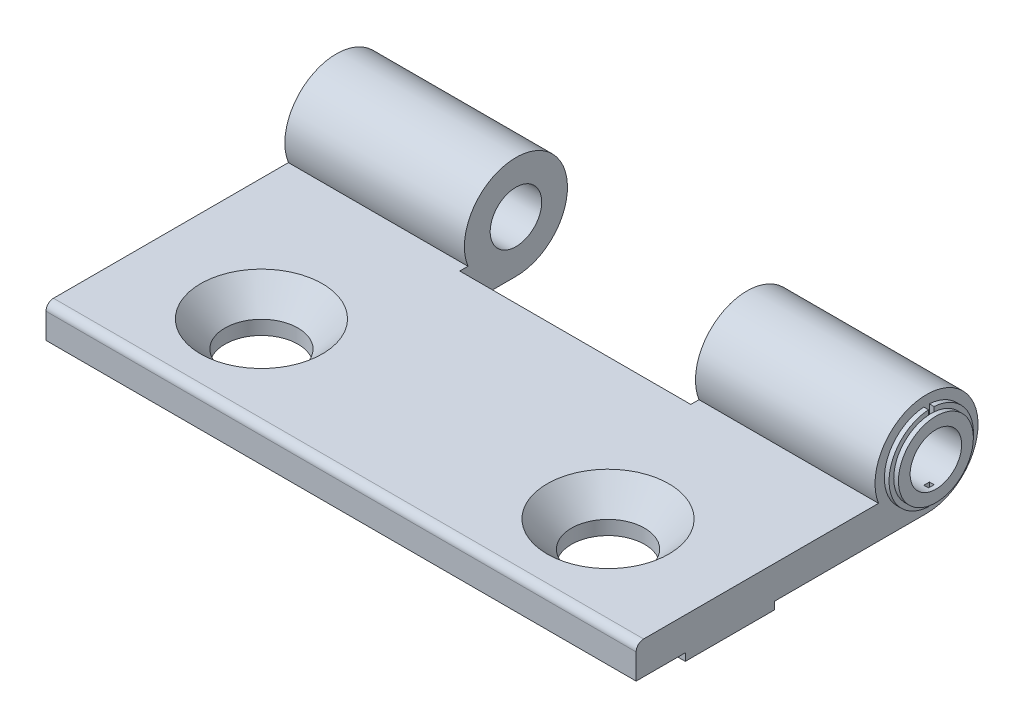
from build123d import *

# Parameters (mm, degrees)
BOSS_EXTRUDE1_DEPTH    = 19.166666667
BOSS_EXTRUDE2_DEPTH    = 0.5
SKETCH3_W              = 5.123475383
SKETCH3_H              = 3.5
BOSS_EXTRUDE3_DEPTH    = 24.666666667
BOSS_EXTRUDE4_START    = 19.166666667
BOSS_EXTRUDE4_DEPTH    = 19.166666667
BOSS_EXTRUDE5_START    = 0.5
BOSS_EXTRUDE5_DEPTH    = 0.5
BOSS_EXTRUDE6_START    = 0.5
BOSS_EXTRUDE6_DEPTH    = 0.5
CUT_EXTRUDE1_DEPTH     = 19.166666667
SKETCH8_W              = 63
SKETCH8_H              = 3.5
BOSS_EXTRUDE7_DEPTH    = 0.338316441
SKETCH9_W              = 63
SKETCH9_H              = 5.461791824
BOSS_EXTRUDE8_DEPTH    = 0.8
CUT_EXTRUDE2_DEPTH     = 5.123475383
SKETCH11_W             = 63
SKETCH11_H             = 4.3
BOSS_EXTRUDE9_DEPTH    = 25.538208176
CUT_EXTRUDE3_DEPTH     = 0.338316441
SKETCH13_W             = 63
SKETCH13_H             = 0.8
CUT_EXTRUDE4_DEPTH     = 10.788208176
SKETCH14_W             = 24.666666666
SKETCH14_H             = 3.5
CUT_EXTRUDE5_DEPTH     = 0.538208176
BOSS_EXTRUDE10_START   = 0.5
SKETCH15_R             = 4
SKETCH15_R_2           = 2.75
BOSS_EXTRUDE10_DEPTH   = 0.5
SKETCH16_R             = 4
BOSS_EXTRUDE11_DEPTH   = 0.5
SKETCH17_W             = 5.25
SKETCH17_H             = 0.8
CUT_EXTRUDE6_DEPTH     = 72.95832127
F_10_CLEARANCE_HOLE1_D = 5.5
HOLE1_AT_2_COUNT       = 2
HOLE1_AT_2_PITCH       = 37
FILLET1_R              = 0.8
SCALE1_SCALE           = 0.3333


with BuildPart() as part:
    # Sketch1 → Boss-Extrude1 (new body)
    with BuildSketch(Plane(origin=(-12.333333333, 0, 0), x_dir=(0, 0, -1), z_dir=(1, 0, 0))):
        with BuildLine():
            Line((-5.123475383, 3.5), (-5.123475383, 0))
            Line((-5.123475383, 0), (0, 0))
            ThreePointArc((0, 0), (3.102418411, 10.041475531), (-5.123475383, 3.5))
        make_face()
    extrude(amount=-BOSS_EXTRUDE1_DEPTH)

    # Sketch2 → Boss-Extrude2 (add)
    with BuildSketch(Plane.ZY.offset(31.5)):
        with BuildLine():
            Line((-0.3, 9.989988864), (-0.3, 8.233587387))
            ThreePointArc((-0.3, 8.233587387), (0, 8.25), (0.3, 8.233587387))
            Line((0.3, 8.233587387), (0.3, 9.989988864))
            ThreePointArc((0.3, 9.989988864), (4.5, 5.5), (0.3, 1.010011136))
            Line((0.3, 1.010011136), (0.3, 2.766412613))
            ThreePointArc((0.3, 2.766412613), (0, 2.75), (-0.3, 2.766412613))
            Line((-0.3, 2.766412613), (-0.3, 1.010011136))
            ThreePointArc((-0.3, 1.010011136), (-4.5, 5.5), (-0.3, 9.989988864))
        make_face()
    extrude(amount=BOSS_EXTRUDE2_DEPTH)

    # Sketch3 → Boss-Extrude3 (add)
    with BuildSketch(Plane(origin=(-12.333333333, 0, 0), x_dir=(0, 0, -1), z_dir=(1, 0, 0))):
        with Locations((-2.561737692, 1.75)):
            Rectangle(SKETCH3_W, SKETCH3_H)
    extrude(amount=BOSS_EXTRUDE3_DEPTH)

    # Sketch4 → Boss-Extrude4 (add)
    with BuildSketch(Plane(origin=(12.333333333, 0, 0), x_dir=(0, 0, -1), z_dir=(1, 0, 0)).offset(BOSS_EXTRUDE4_START)):
        with BuildLine():
            Line((0, 0), (-5.123475383, 0))
            Line((-5.123475383, 0), (-5.123475383, 3.5))
            ThreePointArc((-5.123475383, 3.5), (3.102418411, 10.041475531), (0, 0))
        make_face()
        with BuildLine():
            Line((-1.887458609, 3.5), (0, 3.5))
            Line((0, 3.5), (0, 2.75))
            ThreePointArc((0, 2.75), (1.015504801, 8.055631038), (-1.887458609, 3.5))
        make_face(mode=Mode.SUBTRACT)
    extrude(amount=-BOSS_EXTRUDE4_DEPTH)

    # Sketch5 → Boss-Extrude5 (add)
    with BuildSketch(Plane(origin=(31.5, 0, 0), x_dir=(0, 0, -1), z_dir=(1, 0, 0)).offset(BOSS_EXTRUDE5_START)):
        with BuildLine():
            Line((-0.3, 9.989988864), (-0.3, 8.233587387))
            ThreePointArc((-0.3, 8.233587387), (-2.75, 5.5), (-0.3, 2.766412613))
            Line((-0.3, 2.766412613), (-0.3, 1.010011136))
            ThreePointArc((-0.3, 1.010011136), (-4.5, 5.5), (-0.3, 9.989988864))
        make_face()
    extrude(amount=-BOSS_EXTRUDE5_DEPTH)

    # Sketch6 → Boss-Extrude6 (add)
    with BuildSketch(Plane(origin=(31.5, 0, 0), x_dir=(0, 0, -1), z_dir=(1, 0, 0)).offset(BOSS_EXTRUDE6_START)):
        with BuildLine():
            Line((0.3, 1.010011136), (0.3, 2.766412613))
            ThreePointArc((0.3, 2.766412613), (2.75, 5.5), (0.3, 8.233587387))
            Line((0.3, 8.233587387), (0.3, 9.989988864))
            ThreePointArc((0.3, 9.989988864), (4.5, 5.5), (0.3, 1.010011136))
        make_face()
    extrude(amount=-BOSS_EXTRUDE6_DEPTH)

    # Sketch7 → Cut-Extrude1 (cut)
    with BuildSketch(Plane(origin=(31.5, 0, 0), x_dir=(0, 0, -1), z_dir=(1, 0, 0))):
        with BuildLine():
            Line((0, 3.5), (-1.887458609, 3.5))
            ThreePointArc((-1.887458609, 3.5), (-1.015504801, 2.944368962), (0, 2.75))
            Line((0, 2.75), (0, 3.5))
        make_face()
    extrude(amount=-CUT_EXTRUDE1_DEPTH, mode=Mode.SUBTRACT)

    # Sketch8 → Boss-Extrude7 (add)
    with BuildSketch(Plane.XY.offset(5.123475383)):
        with Locations((0, 1.75)):
            Rectangle(SKETCH8_W, SKETCH8_H)
    extrude(amount=BOSS_EXTRUDE7_DEPTH)

    # Sketch9 → Boss-Extrude8 (add)
    with BuildSketch(Plane.XZ):
        with Locations((0, 2.730895912)):
            Rectangle(SKETCH9_W, SKETCH9_H)
    extrude(amount=BOSS_EXTRUDE8_DEPTH)

    # Sketch10 → Cut-Extrude2 (cut)
    with BuildSketch(Plane(origin=(0, 0, 0), x_dir=(-1, 0, 0), z_dir=(0, 0, -1))):
        Polygon((12.333333333, 3.5), (-12.333333333, 3.5), (-12.333333333, 0), (-31.5, 0), (-31.5, -0.8), (31.5, -0.8), (31.5, 0), (12.333333333, 0), align=None)
    extrude(amount=-CUT_EXTRUDE2_DEPTH, mode=Mode.SUBTRACT)

    # Sketch11 → Boss-Extrude9 (add)
    with BuildSketch(Plane.XY.offset(5.461791824)):
        with Locations((0, 1.35)):
            Rectangle(SKETCH11_W, SKETCH11_H)
    extrude(amount=BOSS_EXTRUDE9_DEPTH)

    # Sketch12 → Cut-Extrude3 (cut)
    with BuildSketch(Plane(origin=(0, 0, 5.123475383), x_dir=(-1, 0, 0), z_dir=(0, 0, -1))):
        Polygon((12.333333333, 3.5), (-12.333333333, 3.5), (-12.333333333, 0), (-31.5, 0), (-31.5, -0.8), (31.5, -0.8), (31.5, 0), (12.333333333, 0), align=None)
    extrude(amount=-CUT_EXTRUDE3_DEPTH, mode=Mode.SUBTRACT)

    # Sketch13 → Cut-Extrude4 (cut)
    with BuildSketch(Plane(origin=(0, 0, 5.461791824), x_dir=(-1, 0, 0), z_dir=(0, 0, -1))):
        with Locations((0, -0.4)):
            Rectangle(SKETCH13_W, SKETCH13_H)
    extrude(amount=-CUT_EXTRUDE4_DEPTH, mode=Mode.SUBTRACT)

    # Sketch14 → Cut-Extrude5 (cut)
    with BuildSketch(Plane(origin=(0, 0, 5.461791824), x_dir=(-1, 0, 0), z_dir=(0, 0, -1))):
        with Locations((0, 1.75)):
            Rectangle(SKETCH14_W, SKETCH14_H)
    extrude(amount=-CUT_EXTRUDE5_DEPTH, mode=Mode.SUBTRACT)

    # Sketch15 → Boss-Extrude10 (add)
    with BuildSketch(Plane(origin=(32, 0, 0), x_dir=(0, 0, -1), z_dir=(1, 0, 0)).offset(BOSS_EXTRUDE10_START)):
        with Locations(Location((0, 5.5, 0), (0, 0, 94.301222305))):
            Circle(SKETCH15_R)
        with Locations((0, 5.5)):
            Circle(SKETCH15_R_2, mode=Mode.SUBTRACT)
    extrude(amount=-BOSS_EXTRUDE10_DEPTH)

    # Sketch16 → Boss-Extrude11 (add)
    with BuildSketch(Plane.ZY.offset(32)):
        with Locations(Location((0, 5.5, 0), (0, 0, 85.698777695))):
            Circle(SKETCH16_R)
    extrude(amount=BOSS_EXTRUDE11_DEPTH)

    # Sketch17 → Cut-Extrude6 (cut, through all)
    with BuildSketch(Plane(origin=(31.5, 0, 0), x_dir=(0, 0, -1), z_dir=(1, 0, 0))):
        with Locations((-28.375, -0.4)):
            Rectangle(SKETCH17_W, SKETCH17_H)
    extrude(amount=-CUT_EXTRUDE6_DEPTH, mode=Mode.SUBTRACT)

    # #10 Clearance Hole1 (through all)
    with Locations(Plane.ZY.offset(32.5)):
        with Locations((0, 5.5)):
            Hole(F_10_CLEARANCE_HOLE1_D / 2)

    # Sketch20 → Hole1 (revolve, cut)
    with BuildSketch(Plane(origin=(18.5, 3.5, 21), x_dir=(0, 0, 1), z_dir=(1, 0, 0))):
        Polygon((0, 0), (0, 4.3), (3.9, 4.3), (3.9, 2.8), (6.5, 0), align=None)
    hole1 = revolve(axis=Axis((18.5, 9.945314094, 21), (0, -1, 0)), mode=Mode.SUBTRACT)

    # Hole1 at 2: Hole1 ×2
    with Locations(*[(-i * HOLE1_AT_2_PITCH, 0, 0) for i in range(1, HOLE1_AT_2_COUNT)]):
        add(hole1, mode=Mode.SUBTRACT)

    # Fillet1
    fillet1_edges = [part.edges().sort_by_distance(p)[0] for p in [
        (0, 3.5, 31),
    ]]
    fillet(fillet1_edges, radius=FILLET1_R)


with BuildPart() as part_1:
    # Scale1: scaled about (0, 2.846153953, 11.820192401)
    add(part.part.scale(SCALE1_SCALE).moved(Location((0, 1.89753084, 7.880522274))))


solid = part_1.part
